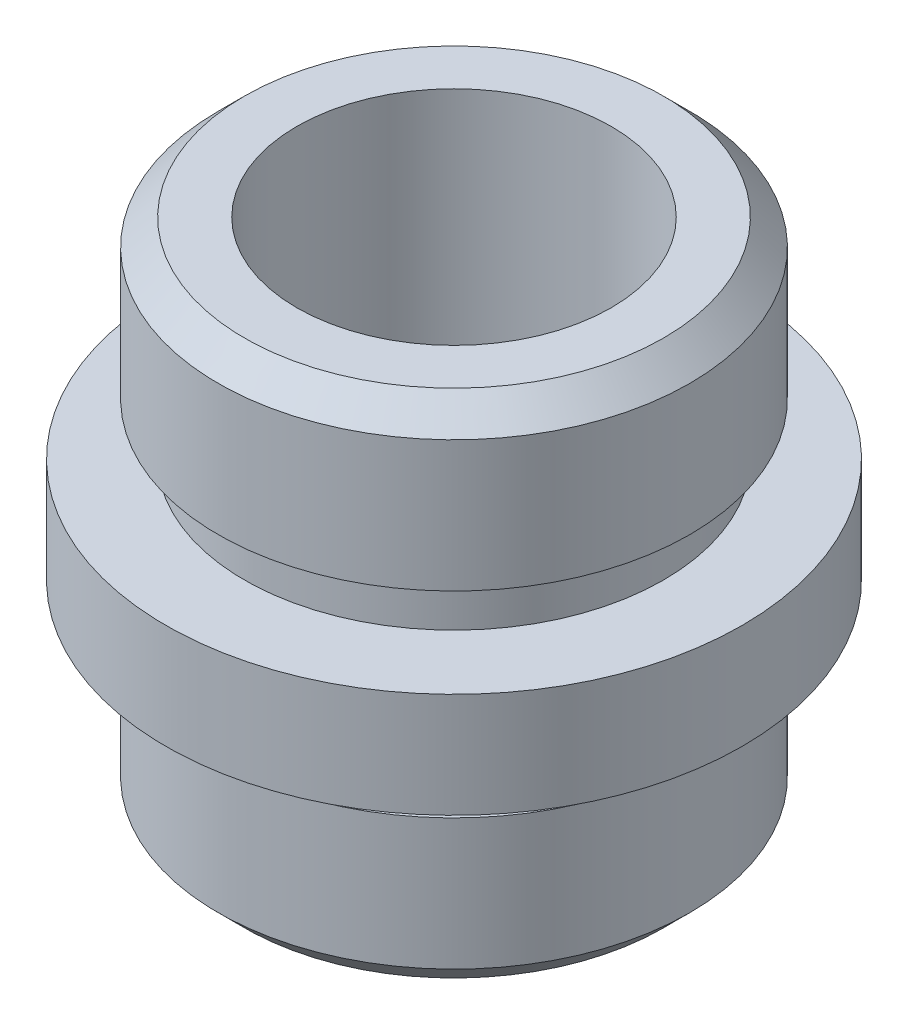
from build123d import *


with BuildPart() as part:
    # Sketch1 → Revolve1 (revolve)
    with BuildSketch(Plane.XY):
        Polygon((-12, -23), (-16, -23), (-18, -21), (-18, -11), (-16, -11), (-16, -8), (-22, -8), (-22, 0), (-16, 0), (-16, 4), (-18, 4), (-18, 14), (-16, 16), (-12, 16), align=None)
    revolve(axis=Axis((0, 26.936808356, 0), (0, -1, 0)))


solid = part.part
